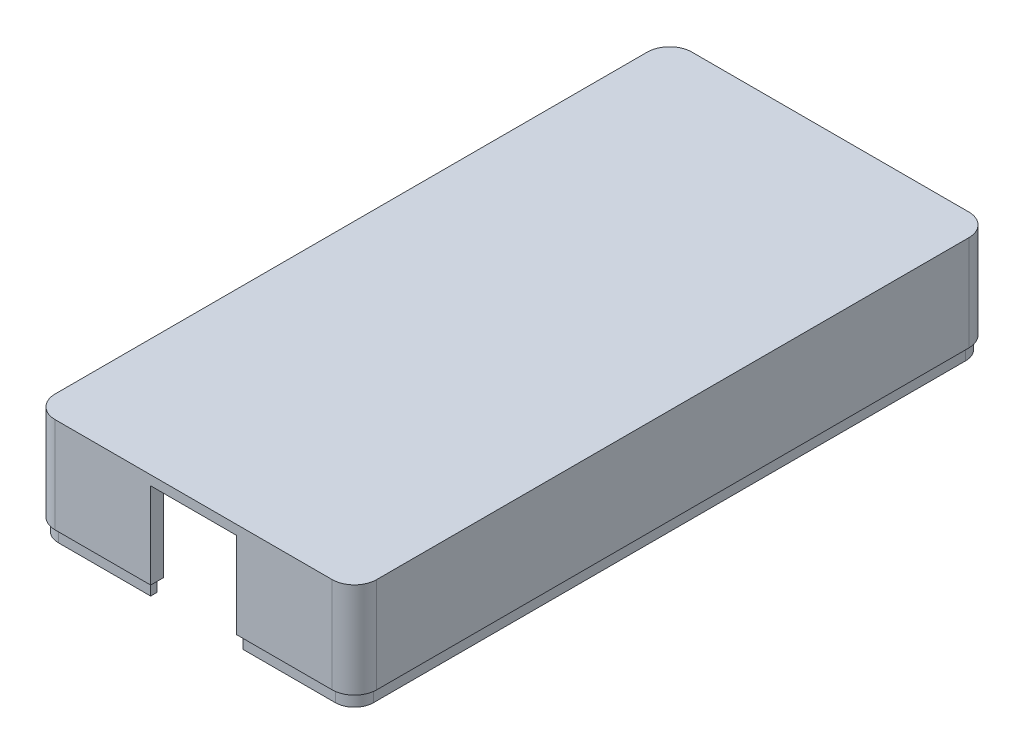
from build123d import *

# Parameters (mm, degrees)
BOSS_EXTRUDE1_DEPTH     = 15
CUT_EXTRUDE1_DEPTH      = 13.5
SKETCH3_W               = 13.5
SKETCH3_H               = 27
CUT_EXTRUDE2_DEPTH      = 15
SALIENTE_EXTRUIR1_DEPTH = 2


with BuildPart() as part:
    # Sketch1 → Boss-Extrude1 (new body)
    with BuildSketch(Plane(origin=(0, 0, 0), x_dir=(1, 0, 0), z_dir=(0, 1, 0))):
        with BuildLine():
            Line((-21.75, -50), (21.75, -50))
            ThreePointArc((21.75, -50), (24.224873734, -48.974873734), (25.25, -46.5))
            Line((25.25, -46.5), (25.25, 46.5))
            ThreePointArc((25.25, 46.5), (24.224873734, 48.974873734), (21.75, 50))
            Line((21.75, 50), (-21.75, 50))
            ThreePointArc((-21.75, 50), (-24.224873734, 48.974873734), (-25.25, 46.5))
            Line((-25.25, 46.5), (-25.25, -46.5))
            ThreePointArc((-25.25, -46.5), (-24.224873734, -48.974873734), (-21.75, -50))
        make_face()
    extrude(amount=BOSS_EXTRUDE1_DEPTH)

    # Sketch2 → Cut-Extrude1 (cut)
    with BuildSketch(Plane.XZ):
        with BuildLine():
            Line((-19.75, -48), (19.75, -48))
            ThreePointArc((19.75, -48), (22.224873734, -46.974873734), (23.25, -44.5))
            Line((23.25, -44.5), (23.25, 44.5))
            ThreePointArc((23.25, 44.5), (22.224873734, 46.974873734), (19.75, 48))
            Line((19.75, 48), (-19.75, 48))
            ThreePointArc((-19.75, 48), (-22.224873734, 46.974873734), (-23.25, 44.5))
            Line((-23.25, 44.5), (-23.25, -44.5))
            ThreePointArc((-23.25, -44.5), (-22.224873734, -46.974873734), (-19.75, -48))
        make_face()
    extrude(amount=-CUT_EXTRUDE1_DEPTH, mode=Mode.SUBTRACT)

    # Sketch3 → Cut-Extrude2 (cut)
    with BuildSketch(Plane.XY.offset(50)):
        Rectangle(SKETCH3_W, SKETCH3_H)
    extrude(amount=-CUT_EXTRUDE2_DEPTH, mode=Mode.SUBTRACT)

    # Croquis3 → Saliente-Extruir1 (add)
    with BuildSketch(Plane.XZ):
        with BuildLine():
            Line((7.25, 48.5), (19.75, 48.5))
            ThreePointArc((19.75, 48.5), (22.578427125, 47.328427125), (23.75, 44.5))
            Line((23.75, 44.5), (23.75, -44.5))
            ThreePointArc((23.75, -44.5), (22.578427125, -47.328427125), (19.75, -48.5))
            Line((19.75, -48.5), (-19.75, -48.5))
            ThreePointArc((-19.75, -48.5), (-22.578427125, -47.328427125), (-23.75, -44.5))
            Line((-23.75, -44.5), (-23.75, 44.5))
            ThreePointArc((-23.75, 44.5), (-22.578427125, 47.328427125), (-19.75, 48.5))
            Line((-19.75, 48.5), (-7.25, 48.5))
            Line((-7.25, 48.5), (-7.25, 49.5))
            Line((-7.25, 49.5), (-21.75, 49.5))
            ThreePointArc((-21.75, 49.5), (-23.871320344, 48.621320344), (-24.75, 46.5))
            Line((-24.75, 46.5), (-24.75, -46.5))
            ThreePointArc((-24.75, -46.5), (-23.871320344, -48.621320344), (-21.75, -49.5))
            Line((-21.75, -49.5), (21.75, -49.5))
            ThreePointArc((21.75, -49.5), (23.871320344, -48.621320344), (24.75, -46.5))
            Line((24.75, -46.5), (24.75, 46.5))
            ThreePointArc((24.75, 46.5), (23.871320344, 48.621320344), (21.75, 49.5))
            Line((21.75, 49.5), (7.25, 49.5))
            Line((7.25, 49.5), (7.25, 48.5))
        make_face()
    extrude(amount=SALIENTE_EXTRUIR1_DEPTH)


solid = part.part
